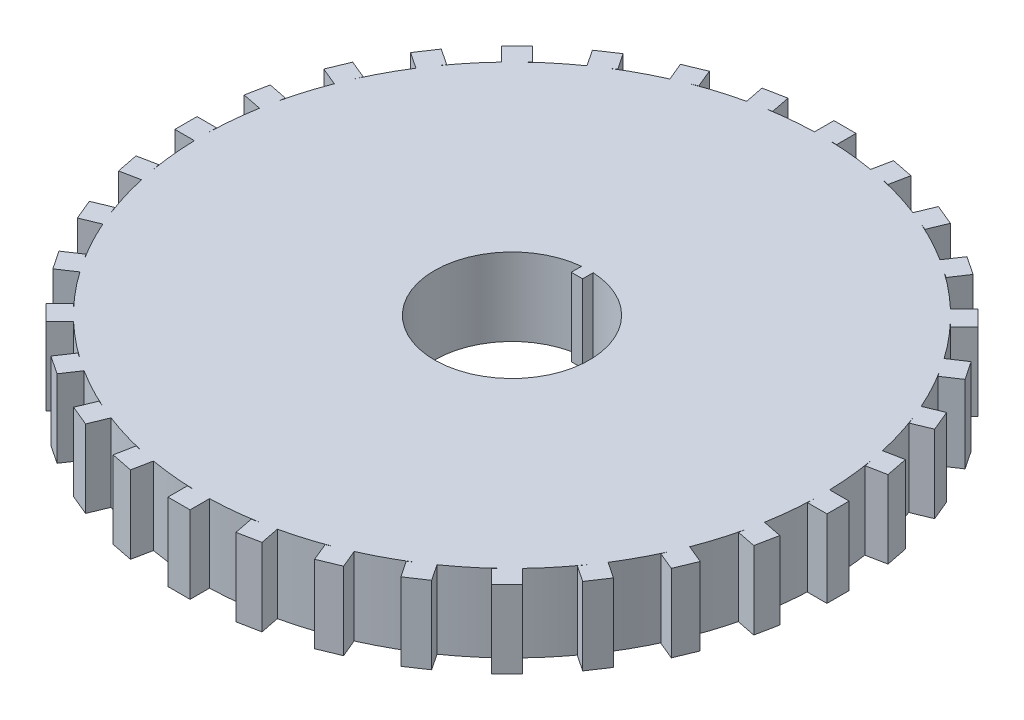
from build123d import *

# Parameters (mm, degrees)
SKETCH1_R           = 25.4
SKETCH1_W           = 1.814083278
SKETCH1_H           = 1.595577256
SKETCH1_W_2         = 1.595577256
SKETCH1_H_2         = 1.814083278
BOSS_EXTRUDE1_DEPTH = 6.35


with BuildPart() as part:
    # Sketch1 → Boss-Extrude1 (new body)
    # profile 1 of 33: a face of its own
    with BuildSketch(Plane(origin=(0, 0, 0), x_dir=(1, 0, 0), z_dir=(0, 1, 0))):
        Circle(SKETCH1_R)
        with BuildLine():
            Line((-0.62166438, 6.319496293), (-0.62166438, 5.475030088))
            Line((-0.62166438, 5.475030088), (0.308287629, 5.475030088))
            Line((0.308287629, 5.475030088), (0.308287629, 6.342512021))
            ThreePointArc((0.308287629, 6.342512021), (0.1571104, -6.348056106), (-0.62166438, 6.319496293))
        make_face(mode=Mode.SUBTRACT)
    # profile 2 of 33: a face of its own
    with BuildSketch(Plane(origin=(0, 0, 0), x_dir=(1, 0, 0), z_dir=(0, 1, 0))):
        Polygon((4.655372194, 26.590682963), (6.434598369, 26.236772872), (6.123316689, 24.671854186), (4.344090513, 25.025764276), align=None)
    # profile 3 of 33: a face of its own
    with BuildSketch(Plane(origin=(0, 0, 0), x_dir=(1, 0, 0), z_dir=(0, 1, 0))):
        with Locations((0.285377259, 26.190179878)):
            Rectangle(SKETCH1_W, SKETCH1_H)
    # profile 4 of 33: a face of its own
    with BuildSketch(Plane(origin=(0, 0, 0), x_dir=(1, 0, 0), z_dir=(0, 1, 0))):
        Polygon((9.753505424, 25.171532385), (11.429499834, 24.47731277), (10.818898853, 23.003191601), (9.142904443, 23.697411216), align=None)
    # profile 5 of 33: a face of its own
    with BuildSketch(Plane(origin=(0, 0, 0), x_dir=(1, 0, 0), z_dir=(0, 1, 0))):
        Polygon((14.476816911, 22.785053935), (15.98517203, 21.777203266), (15.098716802, 20.450529263), (13.590361683, 21.458379932), align=None)
    # profile 6 of 33: a face of its own
    with BuildSketch(Plane(origin=(0, 0, 0), x_dir=(1, 0, 0), z_dir=(0, 1, 0))):
        Polygon((18.643792443, 19.52295864), (19.92654303, 18.240208053), (18.798299532, 17.111964555), (17.515548945, 18.394715142), align=None)
    # profile 7 of 33: a face of its own
    with BuildSketch(Plane(origin=(0, 0, 0), x_dir=(1, 0, 0), z_dir=(0, 1, 0))):
        Polygon((22.094297486, 15.510606992), (23.102148155, 14.002251873), (21.775474153, 13.115796645), (20.767623484, 14.624151764), align=None)
    # profile 8 of 33: a face of its own
    with BuildSketch(Plane(origin=(0, 0, 0), x_dir=(1, 0, 0), z_dir=(0, 1, 0))):
        Polygon((24.695731068, 10.902191417), (25.389950683, 9.226197007), (23.915829514, 8.615596026), (23.221609899, 10.291590436), align=None)
    # profile 9 of 33: a face of its own
    with BuildSketch(Plane(origin=(0, 0, 0), x_dir=(1, 0, 0), z_dir=(0, 1, 0))):
        Polygon((26.348121555, 5.874810739), (26.702031645, 4.095584564), (25.137112959, 3.784302883), (24.783202868, 5.563529059), align=None)
    # profile 10 of 33: a face of its own
    with BuildSketch(Plane(origin=(0, 0, 0), x_dir=(1, 0, 0), z_dir=(0, 1, 0))):
        with Locations((26.190179878, -0.285377259)):
            Rectangle(SKETCH1_W_2, SKETCH1_H_2)
    # profile 11 of 33: a face of its own
    with BuildSketch(Plane(origin=(0, 0, 0), x_dir=(1, 0, 0), z_dir=(0, 1, 0))):
        Polygon((26.590682963, -4.655372194), (26.236772872, -6.434598369), (24.671854186, -6.123316689), (25.025764276, -4.344090513), align=None)
    # profile 12 of 33: a face of its own
    with BuildSketch(Plane(origin=(0, 0, 0), x_dir=(1, 0, 0), z_dir=(0, 1, 0))):
        Polygon((25.171532385, -9.753505424), (24.47731277, -11.429499834), (23.003191601, -10.818898853), (23.697411216, -9.142904443), align=None)
    # profile 13 of 33: a face of its own
    with BuildSketch(Plane(origin=(0, 0, 0), x_dir=(1, 0, 0), z_dir=(0, 1, 0))):
        Polygon((22.785053935, -14.476816911), (21.777203266, -15.98517203), (20.450529263, -15.098716802), (21.458379932, -13.590361683), align=None)
    # profile 14 of 33: a face of its own
    with BuildSketch(Plane(origin=(0, 0, 0), x_dir=(1, 0, 0), z_dir=(0, 1, 0))):
        Polygon((19.52295864, -18.643792443), (18.240208053, -19.92654303), (17.111964555, -18.798299532), (18.394715142, -17.515548945), align=None)
    # profile 15 of 33: a face of its own
    with BuildSketch(Plane(origin=(0, 0, 0), x_dir=(1, 0, 0), z_dir=(0, 1, 0))):
        Polygon((15.510606992, -22.094297486), (14.002251873, -23.102148155), (13.115796645, -21.775474153), (14.624151764, -20.767623484), align=None)
    # profile 16 of 33: a face of its own
    with BuildSketch(Plane(origin=(0, 0, 0), x_dir=(1, 0, 0), z_dir=(0, 1, 0))):
        Polygon((10.902191417, -24.695731068), (9.226197007, -25.389950683), (8.615596026, -23.915829514), (10.291590436, -23.221609899), align=None)
    # profile 17 of 33: a face of its own
    with BuildSketch(Plane(origin=(0, 0, 0), x_dir=(1, 0, 0), z_dir=(0, 1, 0))):
        Polygon((5.874810739, -26.348121555), (4.095584564, -26.702031645), (3.784302883, -25.137112959), (5.563529059, -24.783202868), align=None)
    # profile 18 of 33: a face of its own
    with BuildSketch(Plane(origin=(0, 0, 0), x_dir=(1, 0, 0), z_dir=(0, 1, 0))):
        with Locations((-0.285377259, -26.190179878)):
            Rectangle(SKETCH1_W, SKETCH1_H)
    # profile 19 of 33: a face of its own
    with BuildSketch(Plane(origin=(0, 0, 0), x_dir=(1, 0, 0), z_dir=(0, 1, 0))):
        Polygon((-4.655372194, -26.590682963), (-6.434598369, -26.236772872), (-6.123316689, -24.671854186), (-4.344090513, -25.025764276), align=None)
    # profile 20 of 33: a face of its own
    with BuildSketch(Plane(origin=(0, 0, 0), x_dir=(1, 0, 0), z_dir=(0, 1, 0))):
        Polygon((-9.753505424, -25.171532385), (-11.429499834, -24.47731277), (-10.818898853, -23.003191601), (-9.142904443, -23.697411216), align=None)
    # profile 21 of 33: a face of its own
    with BuildSketch(Plane(origin=(0, 0, 0), x_dir=(1, 0, 0), z_dir=(0, 1, 0))):
        Polygon((-14.476816911, -22.785053935), (-15.98517203, -21.777203266), (-15.098716802, -20.450529263), (-13.590361683, -21.458379932), align=None)
    # profile 22 of 33: a face of its own
    with BuildSketch(Plane(origin=(0, 0, 0), x_dir=(1, 0, 0), z_dir=(0, 1, 0))):
        Polygon((-18.643792443, -19.52295864), (-19.92654303, -18.240208053), (-18.798299532, -17.111964555), (-17.515548945, -18.394715142), align=None)
    # profile 23 of 33: a face of its own
    with BuildSketch(Plane(origin=(0, 0, 0), x_dir=(1, 0, 0), z_dir=(0, 1, 0))):
        Polygon((-22.094297486, -15.510606992), (-23.102148155, -14.002251873), (-21.775474153, -13.115796645), (-20.767623484, -14.624151764), align=None)
    # profile 24 of 33: a face of its own
    with BuildSketch(Plane(origin=(0, 0, 0), x_dir=(1, 0, 0), z_dir=(0, 1, 0))):
        Polygon((-24.695731068, -10.902191417), (-25.389950683, -9.226197007), (-23.915829514, -8.615596026), (-23.221609899, -10.291590436), align=None)
    # profile 25 of 33: a face of its own
    with BuildSketch(Plane(origin=(0, 0, 0), x_dir=(1, 0, 0), z_dir=(0, 1, 0))):
        Polygon((-26.348121555, -5.874810739), (-26.702031645, -4.095584564), (-25.137112959, -3.784302883), (-24.783202868, -5.563529059), align=None)
    # profile 26 of 33: a face of its own
    with BuildSketch(Plane(origin=(0, 0, 0), x_dir=(1, 0, 0), z_dir=(0, 1, 0))):
        with Locations((-26.190179878, 0.285377259)):
            Rectangle(SKETCH1_W_2, SKETCH1_H_2)
    # profile 27 of 33: a face of its own
    with BuildSketch(Plane(origin=(0, 0, 0), x_dir=(1, 0, 0), z_dir=(0, 1, 0))):
        Polygon((-26.590682963, 4.655372194), (-26.236772872, 6.434598369), (-24.671854186, 6.123316689), (-25.025764276, 4.344090513), align=None)
    # profile 28 of 33: a face of its own
    with BuildSketch(Plane(origin=(0, 0, 0), x_dir=(1, 0, 0), z_dir=(0, 1, 0))):
        Polygon((-25.171532385, 9.753505424), (-24.47731277, 11.429499834), (-23.003191601, 10.818898853), (-23.697411216, 9.142904443), align=None)
    # profile 29 of 33: a face of its own
    with BuildSketch(Plane(origin=(0, 0, 0), x_dir=(1, 0, 0), z_dir=(0, 1, 0))):
        Polygon((-22.785053935, 14.476816911), (-21.777203266, 15.98517203), (-20.450529263, 15.098716802), (-21.458379932, 13.590361683), align=None)
    # profile 30 of 33: a face of its own
    with BuildSketch(Plane(origin=(0, 0, 0), x_dir=(1, 0, 0), z_dir=(0, 1, 0))):
        Polygon((-19.52295864, 18.643792443), (-18.240208053, 19.92654303), (-17.111964555, 18.798299532), (-18.394715142, 17.515548945), align=None)
    # profile 31 of 33: a face of its own
    with BuildSketch(Plane(origin=(0, 0, 0), x_dir=(1, 0, 0), z_dir=(0, 1, 0))):
        Polygon((-15.510606992, 22.094297486), (-14.002251873, 23.102148155), (-13.115796645, 21.775474153), (-14.624151764, 20.767623484), align=None)
    # profile 32 of 33: a face of its own
    with BuildSketch(Plane(origin=(0, 0, 0), x_dir=(1, 0, 0), z_dir=(0, 1, 0))):
        Polygon((-10.902191417, 24.695731068), (-9.226197007, 25.389950683), (-8.615596026, 23.915829514), (-10.291590436, 23.221609899), align=None)
    # profile 33 of 33: a face of its own
    with BuildSketch(Plane(origin=(0, 0, 0), x_dir=(1, 0, 0), z_dir=(0, 1, 0))):
        Polygon((-5.874810739, 26.348121555), (-4.095584564, 26.702031645), (-3.784302883, 25.137112959), (-5.563529059, 24.783202868), align=None)
    extrude(amount=BOSS_EXTRUDE1_DEPTH)


solid = part.part
